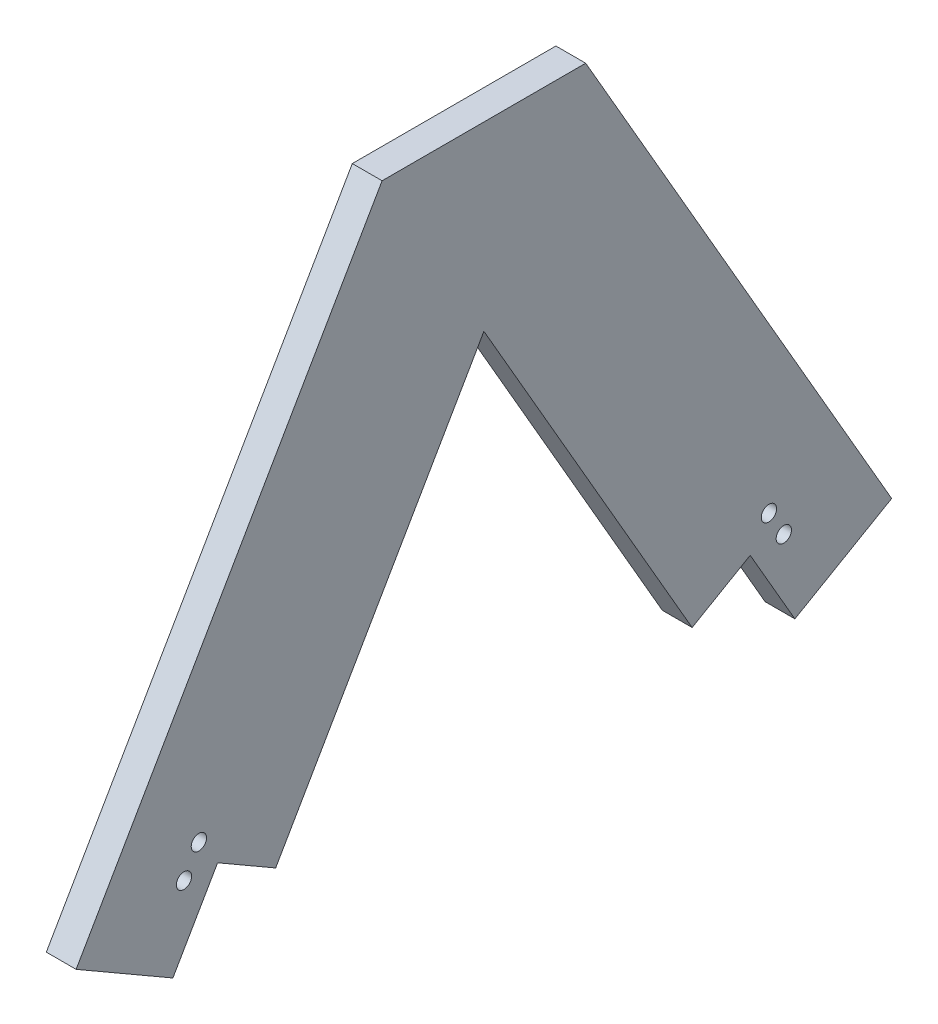
from build123d import *

# Parameters (mm, degrees)
BOSS_EXTRUDE1_DEPTH                            = 6.35
CUT_EXTRUDE1_DEPTH                             = 237.202948439
CUT_EXTRUDE2_DEPTH                             = 237.202948439
CUT_EXTRUDE3_DEPTH                             = 237.202948439
CUT_EXTRUDE4_DEPTH                             = 228.16972734
CSK_FOR_4_FLAT_HEAD_MACHINE_SCREW1_D           = 3.2639
CSK_FOR_4_FLAT_HEAD_MACHINE_SCREW1_CSINK_D     = 5.715
CSK_FOR_4_FLAT_HEAD_MACHINE_SCREW1_CSINK_ANGLE = 82
CSK_FOR_4_FLAT_HEAD_MACHINE_SCREW2_D           = 3.2639
CSK_FOR_4_FLAT_HEAD_MACHINE_SCREW2_CSINK_D     = 5.715
CSK_FOR_4_FLAT_HEAD_MACHINE_SCREW2_CSINK_ANGLE = 82
CSK_FOR_4_FLAT_HEAD_MACHINE_SCREW3_D           = 3.2639
CSK_FOR_4_FLAT_HEAD_MACHINE_SCREW3_CSINK_D     = 5.715
CSK_FOR_4_FLAT_HEAD_MACHINE_SCREW3_CSINK_ANGLE = 82


with BuildPart() as part:
    # Sketch1 → Boss-Extrude1 (new body)
    with BuildSketch(Plane(origin=(0, 0, 0), x_dir=(0, 0, -1), z_dir=(1, 0, 0))):
        Polygon((0, 0), (76.2, 131.982271537), (119.58608314, 131.982271537), (195.78608314, 0), (151.791992628, 0), (97.89304157, 93.355721707), (43.994090512, 0), align=None)
    extrude(amount=BOSS_EXTRUDE1_DEPTH)

    # Sketch2 → Cut-Extrude1 (cut, through all)
    with BuildSketch(Plane(origin=(6.35, 0, 0), x_dir=(0, 0, -1), z_dir=(1, 0, 0))):
        Polygon((43.994090512, 0), (10.998522628, 19.05), (0, 0), align=None)
    extrude(amount=-CUT_EXTRUDE1_DEPTH, mode=Mode.SUBTRACT)

    # Sketch3 → Cut-Extrude2 (cut, through all)
    with BuildSketch(Plane(origin=(6.35, 0, 0), x_dir=(0, 0, -1), z_dir=(1, 0, 0))):
        Polygon((43.994090512, 0), (31.620752556, 7.14375), (41.145752556, 23.641533942), (53.519090512, 16.497783942), align=None)
    extrude(amount=-CUT_EXTRUDE2_DEPTH, mode=Mode.SUBTRACT)

    # Sketch4 → Cut-Extrude3 (cut, through all)
    with BuildSketch(Plane(origin=(6.35, 0, 0), x_dir=(0, 0, -1), z_dir=(1, 0, 0))):
        Polygon((151.791992628, 0), (184.787560512, 19.05), (195.78608314, 0), align=None)
    extrude(amount=-CUT_EXTRUDE3_DEPTH, mode=Mode.SUBTRACT)

    # Sketch5 → Cut-Extrude4 (cut, through all)
    with BuildSketch(Plane(origin=(6.35, 0, 0), x_dir=(0, 0, -1), z_dir=(1, 0, 0))):
        Polygon((151.791992628, 0), (164.165330584, 7.14375), (154.640330584, 23.641533942), (142.266992628, 16.497783942), align=None)
    extrude(amount=-CUT_EXTRUDE4_DEPTH, mode=Mode.SUBTRACT)

    # CSK for #4 Flat Head Machine Screw1 (through all)
    with Locations(Plane.ZY):
        with Locations((-161.803140841, 23.935182653)):
            CounterSinkHole(CSK_FOR_4_FLAT_HEAD_MACHINE_SCREW1_D / 2, CSK_FOR_4_FLAT_HEAD_MACHINE_SCREW1_CSINK_D / 2, counter_sink_angle=CSK_FOR_4_FLAT_HEAD_MACHINE_SCREW1_CSINK_ANGLE)

    # CSK for #4 Flat Head Machine Screw2 (through all)
    with Locations(Plane.ZY):
        with Locations((-158.628140841, 29.434443967)):
            CounterSinkHole(CSK_FOR_4_FLAT_HEAD_MACHINE_SCREW2_D / 2, CSK_FOR_4_FLAT_HEAD_MACHINE_SCREW2_CSINK_D / 2, counter_sink_angle=CSK_FOR_4_FLAT_HEAD_MACHINE_SCREW2_CSINK_ANGLE)

    # CSK for #4 Flat Head Machine Screw3 (through all)
    with Locations(Plane.ZY):
        with Locations((-37.157942299, 29.434443967), (-33.982942299, 23.935182653)):
            CounterSinkHole(CSK_FOR_4_FLAT_HEAD_MACHINE_SCREW3_D / 2, CSK_FOR_4_FLAT_HEAD_MACHINE_SCREW3_CSINK_D / 2, counter_sink_angle=CSK_FOR_4_FLAT_HEAD_MACHINE_SCREW3_CSINK_ANGLE)


solid = part.part
